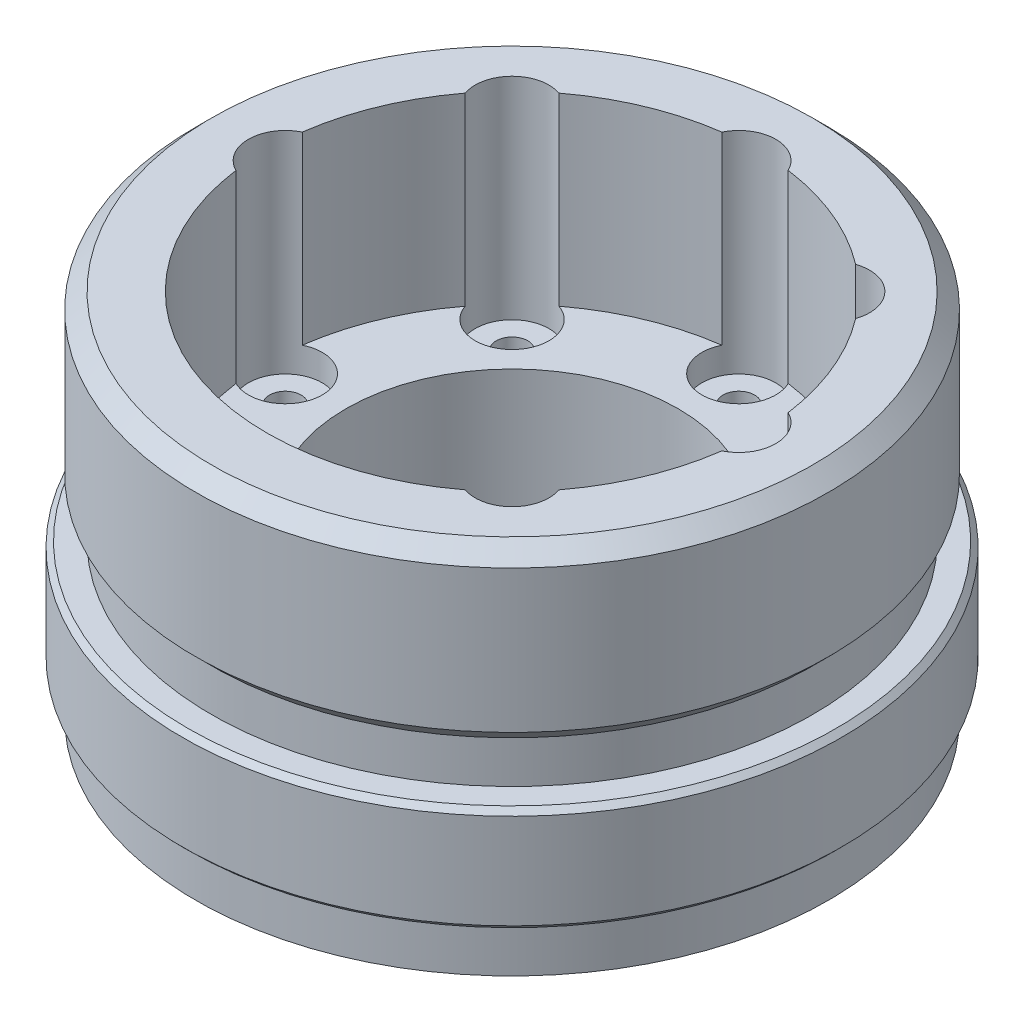
from build123d import *

# Parameters (mm, degrees)
PATTERN_CIRCULAR_1_COUNT = 8


with BuildPart() as part:
    # Эскиз1 → Повернуть1 (revolve)
    with BuildSketch(Plane.XY, mode=Mode.PRIVATE) as revolve_1_sk:
        Polygon((-42, 0), (-60, 0), (-60, 9), (-61.5, 9), (-62.5, 10), (-62.5, 28), (-61.5, 29), (-57, 29), (-57, 37), (-60, 40), (-60, 67), (-57, 70), (-46.5, 70), (-46.5, 35), (-31.5, 35), (-31.5, 10), (-42, 10), align=None)
    revolve(revolve_1_sk.sketch.rotate(Axis((0, 0, 0), (0, 1, 0)), 270), axis=Axis((0, 0, 0), (0, 1, 0)))

    # Эскиз5 → Вырез-Повернуть1 (revolve, cut)
    with BuildSketch(Plane.XY):
        Polygon((-43, 0), (-46, 0), (-46, 30), (-50, 30), (-50, 70), (-43, 70), align=None)
    cut_revolve_1 = revolve(axis=Axis((-43, 84.512066433, 0), (0, -1, 0)), mode=Mode.SUBTRACT)

    # Круговой массив1: Вырез-Повернуть1 ×8 about axis, 2 skipped
    pattern_circular_1_axis = Axis((0, 0, 0), (0, -1, 0))
    add([cut_revolve_1.rotate(pattern_circular_1_axis, i * 360 / PATTERN_CIRCULAR_1_COUNT) for i in range(1, PATTERN_CIRCULAR_1_COUNT) if i not in (6, 7)], mode=Mode.SUBTRACT)


solid = part.part
